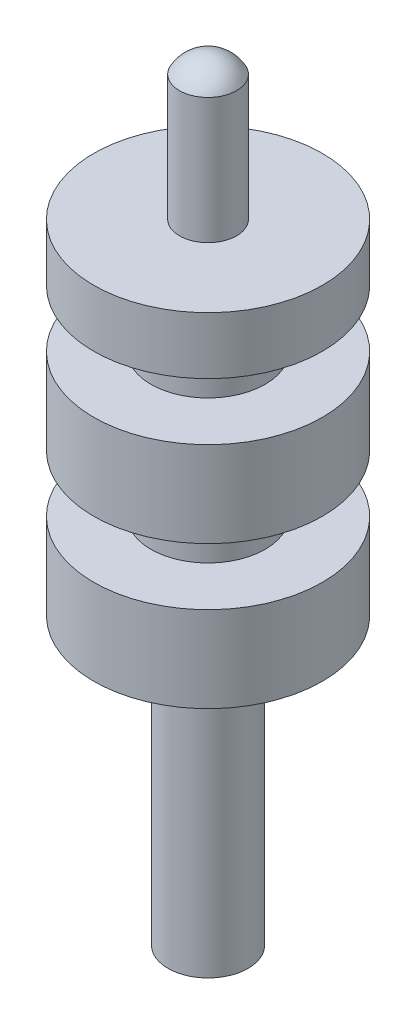
from build123d import *

# Parameters (mm, degrees)
CUT_EXTRUDE_START   = -4
SKETCH_2_R          = 0.5
CUT_EXTRUDE_1_DEPTH = 4
DOME_1_FACE_RADIUS  = 0.5
DOME_1_HEIGHT       = 0.3


with BuildPart() as part:
    # 草图1 → 旋转2 (revolve)
    with BuildSketch(Plane.XY):
        Polygon((0, 13.2), (0, 0), (0.7, 0), (0.7, 5), (2, 5), (2, 6.5), (1, 6.5), (1, 7.5), (2, 7.5), (2, 9), (1, 9), (1, 10), (2, 10), (2, 11), (0.5, 11), (0.5, 13.2), align=None)
    revolve(axis=Axis((0, 0, 0), (0, 1, 0)))

    # 草图2 → 切除-拉伸1 (cut)
    with BuildSketch(Plane(origin=(0, 0, 0), x_dir=(-1, 0, 0), z_dir=(0, -1, 0)).offset(CUT_EXTRUDE_START)):
        with Locations(Location((0, 0, 0), (0, 0, 180))):
            Circle(SKETCH_2_R)
    extrude(amount=CUT_EXTRUDE_1_DEPTH, mode=Mode.SUBTRACT)

    # 圆顶1: a dome of height H over a round flat face of radius A is a cap of a sphere of radius (A * A + H * H) / (2 * H)
    dome_1_r = (DOME_1_FACE_RADIUS * DOME_1_FACE_RADIUS + DOME_1_HEIGHT * DOME_1_HEIGHT) / (2 * DOME_1_HEIGHT)
    dome_1_base = Plane((0, 13.2, 0), z_dir=(0, 1, 0))
    with Locations(dome_1_base.offset(DOME_1_HEIGHT - dome_1_r)):
        dome_1_ball = Sphere(dome_1_r, mode=Mode.PRIVATE)
    add(split(dome_1_ball, bisect_by=dome_1_base, keep=Keep.TOP, mode=Mode.PRIVATE))


solid = part.part
